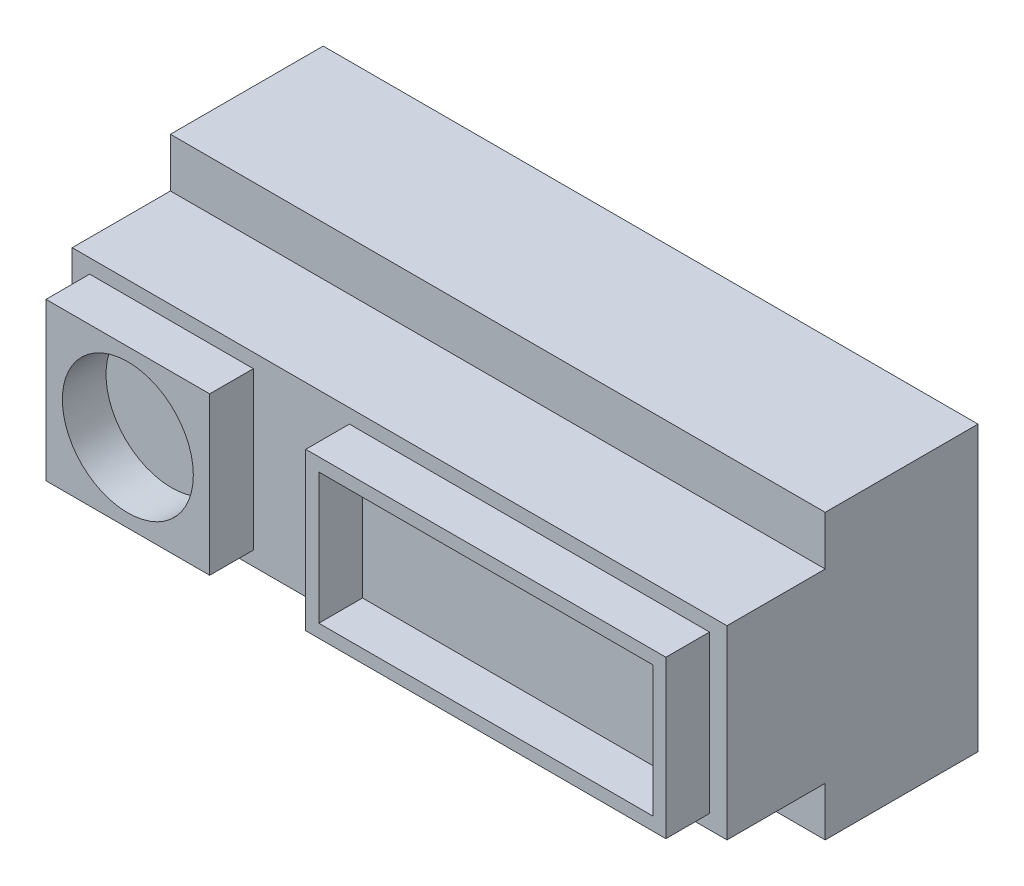
from build123d import *

# Parameters (mm, degrees)
SKETCH_1_W          = 30
SKETCH_1_H          = 13
EXTRUDE_1_DEPTH     = 1.4
SKETCH_2_W          = 30
SKETCH_2_H          = 13
EXTRUDE_2_DEPTH     = 4
SKETCH_3_W          = 30
SKETCH_3_H          = 13
EXTRUDE_3_DEPTH     = 1.6
SKETCH_4_W          = 30
SKETCH_4_H          = 8.5
EXTRUDE_4_DEPTH     = 4.5
SKETCH_6_W          = 16.5
SKETCH_6_H          = 7.2
SKETCH_6_W_2        = 15.3
SKETCH_6_H_2        = 6
SKETCH_6_W_3        = 7.5
SKETCH_6_R          = 3
EXTRUDE_5_DEPTH     = 2
SKETCH_7_W          = 10.5
SKETCH_7_H          = 4.5
CUT_EXTRUDE_1_DEPTH = 12
SKETCH_8_W          = 10
SKETCH_8_H          = 1.1
EXTRUDE_6_DEPTH     = 8.05


with BuildPart() as part:
    # Эскиз1 → Бобышка-Вытянуть1 (new body)
    with BuildSketch(Plane.XY):
        with Locations((0, 6.5)):
            Rectangle(SKETCH_1_W, SKETCH_1_H)
    extrude(amount=EXTRUDE_1_DEPTH)

    # Эскиз2 → Бобышка-Вытянуть2 (add)
    with BuildSketch(Plane.XY.offset(1.4)):
        with Locations((0, 6.5)):
            Rectangle(SKETCH_2_W, SKETCH_2_H)
    extrude(amount=EXTRUDE_2_DEPTH)

    # Эскиз3 → Бобышка-Вытянуть3 (add)
    with BuildSketch(Plane.XY.offset(5.4)):
        with Locations((0, 6.5)):
            Rectangle(SKETCH_3_W, SKETCH_3_H)
    extrude(amount=EXTRUDE_3_DEPTH)

    # Эскиз4 → Бобышка-Вытянуть4 (add)
    with BuildSketch(Plane.XY.offset(7)):
        with Locations((0, 6.5)):
            Rectangle(SKETCH_4_W, SKETCH_4_H)
    extrude(amount=EXTRUDE_4_DEPTH)

    # Эскиз6 → Бобышка-Вытянуть5 (add)
    # profile 1 of 2: a face of its own
    with BuildSketch(Plane.XY.offset(11.5)):
        with Locations((5.95, 6.5)):
            Rectangle(SKETCH_6_W, SKETCH_6_H)
        with Locations((5.95, 6.5)):
            Rectangle(SKETCH_6_W_2, SKETCH_6_H_2, mode=Mode.SUBTRACT)
    # profile 2 of 2: a face of its own
    with BuildSketch(Plane.XY.offset(11.5)):
        with Locations((-10.45, 6.5)):
            Rectangle(SKETCH_6_W_3, SKETCH_6_H)
        with Locations((-10.45, 6.5)):
            Circle(SKETCH_6_R, mode=Mode.SUBTRACT)
    extrude(amount=EXTRUDE_5_DEPTH)

    # Эскиз7 → Вырез-Вытянуть1 (cut)
    with BuildSketch(Plane.XY.offset(7)):
        Rectangle(SKETCH_7_W, SKETCH_7_H)
    extrude(amount=-CUT_EXTRUDE_1_DEPTH, mode=Mode.SUBTRACT)

    # Эскиз8 → Бобышка-Вытянуть6 (add)
    with BuildSketch(Plane.XZ.offset(-2.25)):
        with Locations((0, 3.05)):
            Rectangle(SKETCH_8_W, SKETCH_8_H)
    extrude(amount=EXTRUDE_6_DEPTH)


solid = part.part
